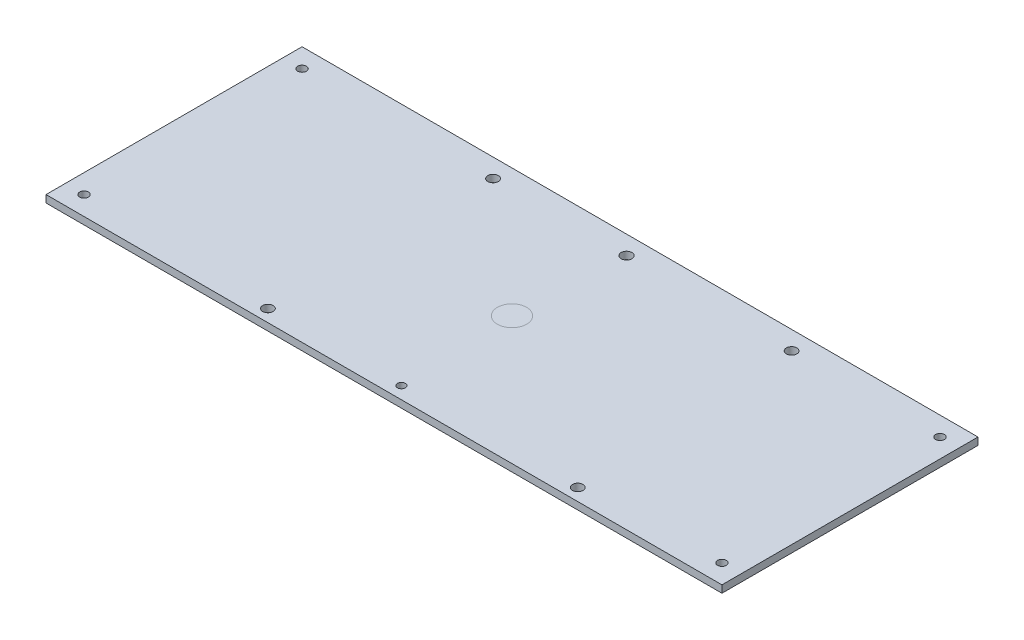
from build123d import *

# Parameters (mm, degrees)
SKETCH_1_W               = 462
SKETCH_1_H               = 175
EXTRUDE_1_DEPTH          = 5
CUT_EXTRUDE_1_DEPTH      = 290.846511105
CUT_EXTRUDE_1_DEPTH_BACK = 290.846511105
SKETCH_2_R               = 3
CUT_EXTRUDE_3_DEPTH      = 290.846511105
CUT_EXTRUDE_3_DEPTH_BACK = 290.846511105
SKETCH_5_R               = 3.579286829
SKETCH_5_R_2             = 3.703820796
SKETCH_5_R_3             = 2.693687851


with BuildPart() as part:
    # 草图1 → 凸台-拉伸1 (new body)
    with BuildSketch(Plane(origin=(0, 0, 0), x_dir=(1, 0, 0), z_dir=(0, 1, 0))):
        with Locations((0, 87.5)):
            Rectangle(SKETCH_1_W, SKETCH_1_H)
    extrude(amount=EXTRUDE_1_DEPTH)

    # 草图2 → 切除-拉伸1 (cut, two sides: drawn at the far end of the back side and taken through both)
    with BuildSketch(Plane.XZ.offset(-CUT_EXTRUDE_1_DEPTH_BACK)):
        with Locations((218, -162)):
            Circle(SKETCH_2_R)
        with Locations((218, -13)):
            Circle(SKETCH_2_R)
        with Locations((-218, -13)):
            Circle(SKETCH_2_R)
        with Locations((-218, -162)):
            Circle(SKETCH_2_R)
    extrude(amount=CUT_EXTRUDE_1_DEPTH + CUT_EXTRUDE_1_DEPTH_BACK, mode=Mode.SUBTRACT)

    # 草图5 → 切除-拉伸3 (cut, two sides: drawn at the far end of the back side and taken through both)
    with BuildSketch(Plane(origin=(0, 5, 0), x_dir=(1, 0, 0), z_dir=(0, 1, 0)).offset(-CUT_EXTRUDE_3_DEPTH_BACK)):
        with Locations((-87.713210657, 162.249837873)):
            Circle(SKETCH_5_R)
        with Locations((-87.713210657, 8.372919369)):
            Circle(SKETCH_5_R)
        with Locations((116.333644077, 162.249837873)):
            Circle(SKETCH_5_R)
        with Locations((124.077996649, 8.372919369)):
            Circle(SKETCH_5_R)
        with Locations((3.535465305, 162.249837873)):
            Circle(SKETCH_5_R_2)
        with Locations((3.535465305, 8.372919369)):
            Circle(SKETCH_5_R_3)
    extrude(amount=CUT_EXTRUDE_3_DEPTH + CUT_EXTRUDE_3_DEPTH_BACK, mode=Mode.SUBTRACT)


solid = part.part
